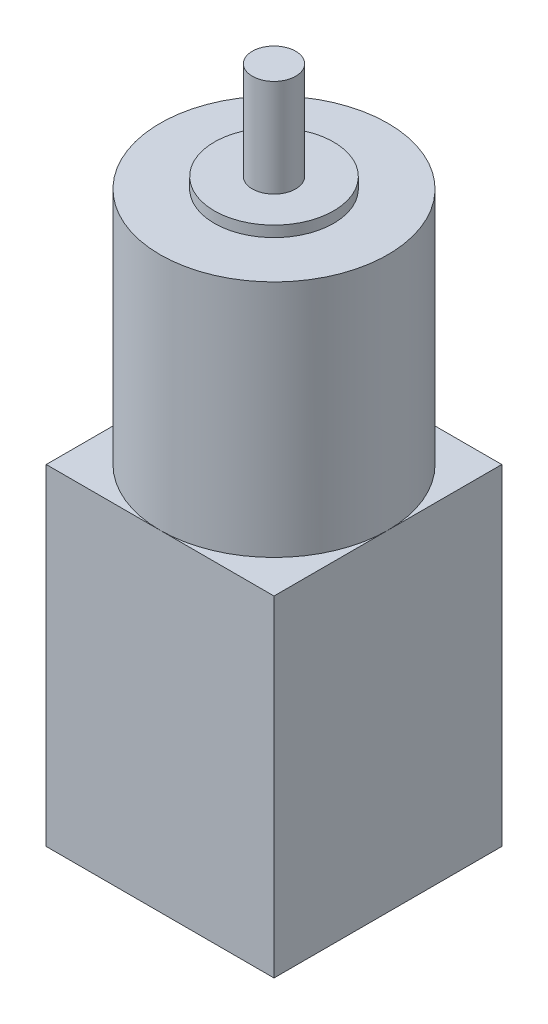
from build123d import *

# Parameters (mm, degrees)
SKETCH1_W           = 42
SKETCH1_H           = 42
BOSS_EXTRUDE1_DEPTH = 61
SKETCH2_R           = 21
BOSS_EXTRUDE2_DEPTH = 44
SKETCH3_R           = 11
BOSS_EXTRUDE3_DEPTH = 2
SKETCH4_R           = 4
BOSS_EXTRUDE4_DEPTH = 18


with BuildPart() as part:
    # Sketch1 → Boss-Extrude1 (new body)
    with BuildSketch(Plane(origin=(0, 0, 0), x_dir=(1, 0, 0), z_dir=(0, 1, 0))):
        with Locations((21, 21)):
            Rectangle(SKETCH1_W, SKETCH1_H)
    extrude(amount=BOSS_EXTRUDE1_DEPTH)

    # Sketch2 → Boss-Extrude2 (add)
    with BuildSketch(Plane(origin=(0, 61, 0), x_dir=(1, 0, 0), z_dir=(0, 1, 0))):
        with Locations(Location((21, 21, 0), (0, 0, 270))):
            Circle(SKETCH2_R)
    extrude(amount=BOSS_EXTRUDE2_DEPTH)

    # Sketch3 → Boss-Extrude3 (add)
    with BuildSketch(Plane(origin=(0, 105, 0), x_dir=(1, 0, 0), z_dir=(0, 1, 0))):
        with Locations(Location((21, 21, 0), (0, 0, 270))):
            Circle(SKETCH3_R)
    extrude(amount=BOSS_EXTRUDE3_DEPTH)

    # Sketch4 → Boss-Extrude4 (add)
    with BuildSketch(Plane(origin=(0, 107, 0), x_dir=(1, 0, 0), z_dir=(0, 1, 0))):
        with Locations(Location((21, 21, 0), (0, 0, 270))):
            Circle(SKETCH4_R)
    extrude(amount=BOSS_EXTRUDE4_DEPTH)


solid = part.part
